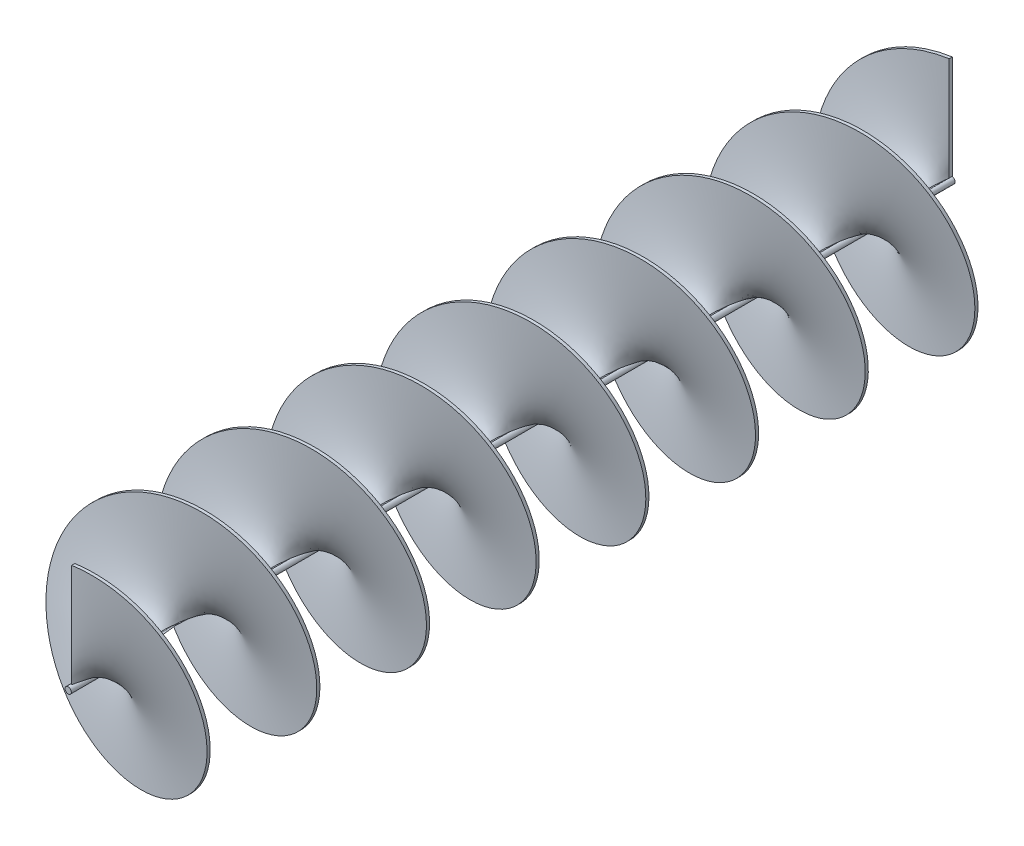
from build123d import *

# Parameters (mm, degrees)
SKETCH_1_R          = 1
EXTRUDE_1_DEPTH     = 282
SWEEP_1_PITCH       = 35
SWEEP_1_HEIGHT      = 280
SWEEP_1_RADIUS      = 1
SWEEP_1_START_ANGLE = 90
SKETCH_6_W          = 1
SKETCH_6_H          = 33


with BuildPart() as part:
    # 草图1 → 凸台-拉伸1 (new body)
    with BuildSketch(Plane.XY):
        Circle(SKETCH_1_R)
    extrude(amount=EXTRUDE_1_DEPTH)

    # 扫描1: sweep along a helix
    with BuildLine() as sweep_1_path:
        add(Helix(SWEEP_1_PITCH, SWEEP_1_HEIGHT, SWEEP_1_RADIUS, center=(0, 0, 0), direction=(0, 0, 1), mode=Mode.PRIVATE).rotate(Axis((0, 0, 0), (0, 0, 1)), SWEEP_1_START_ANGLE))
    # 草图6 → 扫描1 (sweep)
    with BuildSketch(Plane(origin=(0, 0, 0), x_dir=(0, 0, -1), z_dir=(1, 0, 0))):
        with Locations((-0.391545629, 17.5)):
            Rectangle(SKETCH_6_W, SKETCH_6_H)
    sweep(path=sweep_1_path.line, is_frenet=True)


solid = part.part
